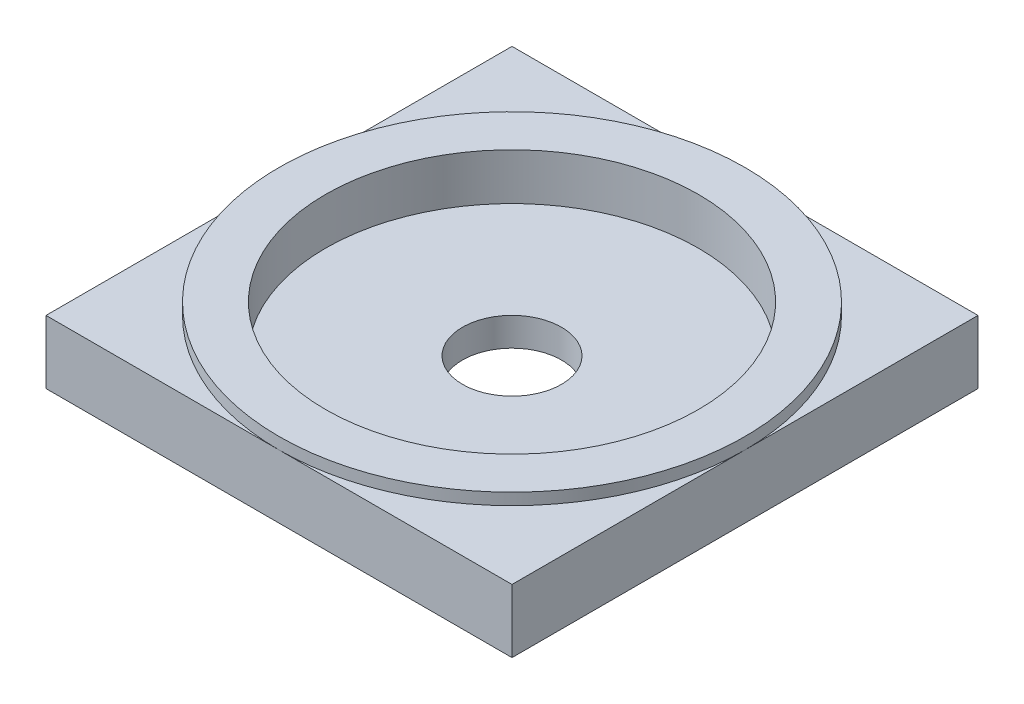
from build123d import *

# Parameters (mm, degrees)
SKETCH2_W           = 63.5
SKETCH2_H           = 63.5
BOSS_EXTRUDE1_DEPTH = 8.636
SKETCH3_R           = 31.75
BOSS_EXTRUDE2_DEPTH = 1.5875
SKETCH4_R           = 25.4
CUT_EXTRUDE1_DEPTH  = 6.35
SKETCH5_R           = 6.74624
CUT_EXTRUDE3_DEPTH  = 46.348070521


with BuildPart() as part:
    # Sketch2 → Boss-Extrude1 (new body)
    with BuildSketch(Plane(origin=(0, 0, 0), x_dir=(1, 0, 0), z_dir=(0, 1, 0))):
        Rectangle(SKETCH2_W, SKETCH2_H)
    extrude(amount=-BOSS_EXTRUDE1_DEPTH)

    # Sketch3 → Boss-Extrude2 (add)
    with BuildSketch(Plane(origin=(0, 0, 0), x_dir=(1, 0, 0), z_dir=(0, 1, 0))):
        with Locations(Location((0, 0, 0), (0, 0, 270))):
            Circle(SKETCH3_R)
    extrude(amount=BOSS_EXTRUDE2_DEPTH)

    # Sketch4 → Cut-Extrude1 (cut)
    with BuildSketch(Plane(origin=(0, 1.5875, 0), x_dir=(1, 0, 0), z_dir=(0, 1, 0))):
        with Locations(Location((0, 0, 0), (0, 0, 270))):
            Circle(SKETCH4_R)
    extrude(amount=-CUT_EXTRUDE1_DEPTH, mode=Mode.SUBTRACT)

    # Sketch5 → Cut-Extrude3 (cut, through all)
    with BuildSketch(Plane(origin=(0, -4.7625, 0), x_dir=(1, 0, 0), z_dir=(0, 1, 0))):
        with Locations(Location((0, 0, 0), (0, 0, 270))):
            Circle(SKETCH5_R)
    extrude(amount=-CUT_EXTRUDE3_DEPTH, mode=Mode.SUBTRACT)


solid = part.part
